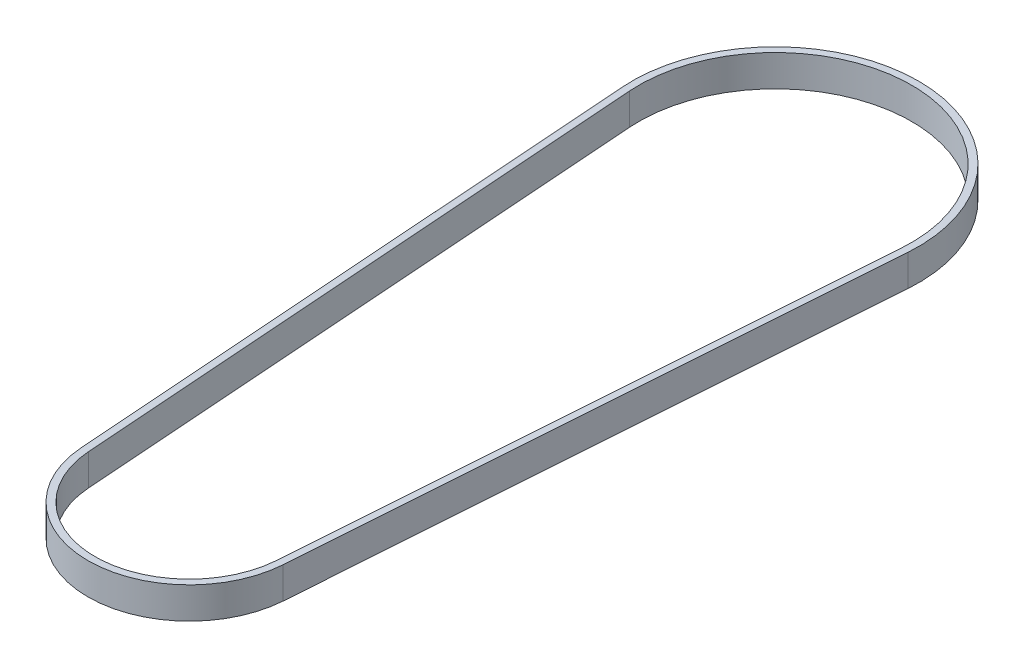
from build123d import *

# Parameters (mm, degrees)
BOSS_EXTRUDE1_DEPTH = 4.5


with BuildPart() as part:
    # Sketch2 → Boss-Extrude1 (new body)
    with BuildSketch(Plane(origin=(0, 0, 0), x_dir=(1, 0, 0), z_dir=(0, 1, 0))):
        with BuildLine():
            Line((20.447399216, -1.467605298), (14.462794567, -84.848062284))
            ThreePointArc((14.462794567, -84.848062284), (0, -98.31), (-14.462794567, -84.848062284))
            Line((-14.462794567, -84.848062284), (-20.447399216, -1.467605298))
            ThreePointArc((-20.447399216, -1.467605298), (0, 20.5), (20.447399216, -1.467605298))
        make_face()
        with BuildLine():
            Line((-19.449965108, -1.396014795), (-13.465360459, -84.776471781))
            ThreePointArc((-13.465360459, -84.776471781), (0, -97.31), (13.465360459, -84.776471781))
            Line((13.465360459, -84.776471781), (19.449965108, -1.396014795))
            ThreePointArc((19.449965108, -1.396014795), (0, 19.5), (-19.449965108, -1.396014795))
        make_face(mode=Mode.SUBTRACT)
    extrude(amount=BOSS_EXTRUDE1_DEPTH)


solid = part.part
